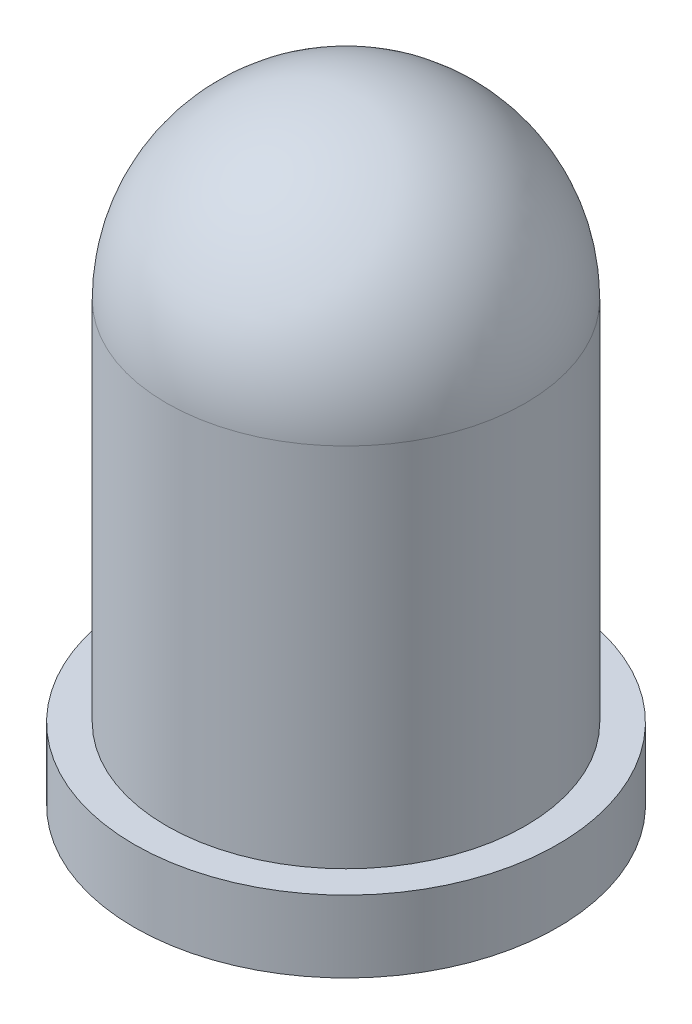
from build123d import *

# Parameters (mm, degrees)
ESBO_O1_R                = 2.95
RESSALTO_EXTRUS_O1_DEPTH = 1
ESBO_O2_R                = 2.5
RESSALTO_EXTRUS_O2_DEPTH = 7.6
FILETE2_R                = 2.5


with BuildPart() as part:
    # Esboço1 → Ressalto-extrusão1 (new body)
    with BuildSketch(Plane(origin=(0, 0, 0), x_dir=(1, 0, 0), z_dir=(0, 1, 0))):
        with Locations(Location((0, 0, 0), (0, 0, 270))):
            Circle(ESBO_O1_R)
    extrude(amount=RESSALTO_EXTRUS_O1_DEPTH)

    # Esboço2 → Ressalto-extrusão2 (add)
    with BuildSketch(Plane(origin=(0, 1, 0), x_dir=(1, 0, 0), z_dir=(0, 1, 0))):
        with Locations(Location((0, 0, 0), (0, 0, 90))):
            Circle(ESBO_O2_R)
    extrude(amount=RESSALTO_EXTRUS_O2_DEPTH)

    # Filete2
    filete2_edges = [part.edges().sort_by_distance(p)[0] for p in [
        (0, 8.6, 2.5),
    ]]
    fillet(filete2_edges, radius=FILETE2_R)


solid = part.part
